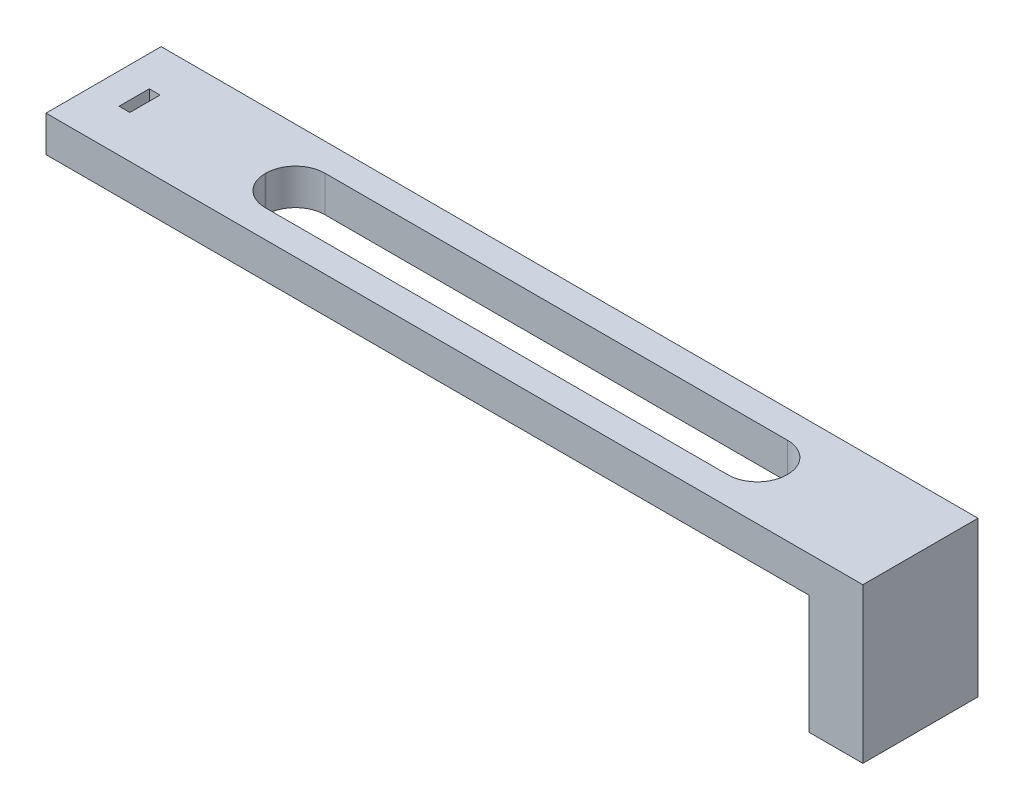
from build123d import *

# Parameters (mm, degrees)
EXTRUDE_1_DEPTH     = 16
SKETCH_2_W          = 1.5
SKETCH_2_H          = 4.2
SKETCH_2_W_2        = 72.5
SKETCH_2_H_2        = 8.3
CUT_EXTRUDE_1_DEPTH = 109.463127375
FILLET_1_R          = 4.1


with BuildPart() as part:
    # 스케치1 → 보스-돌출1 (new body)
    with BuildSketch(Plane.XY):
        Polygon((-106, 0), (0, 0), (0, -16.5), (7.5, -16.5), (7.5, 5), (-106, 5), align=None)
    extrude(amount=EXTRUDE_1_DEPTH)

    # 스케치2 → 컷-돌출1 (cut, through all)
    with BuildSketch(Plane.XZ):
        with Locations((-101, 8)):
            Rectangle(SKETCH_2_W, SKETCH_2_H)
        with Locations((-47.25, 8)):
            Rectangle(SKETCH_2_W_2, SKETCH_2_H_2)
    extrude(amount=-CUT_EXTRUDE_1_DEPTH, mode=Mode.SUBTRACT)

    # 필렛1
    fillet_1_edges = [part.edges().sort_by_distance(p)[0] for p in [
        (-83.5, 2.5, 3.85),
        (-83.5, 2.5, 12.15),
        (-11, 2.5, 12.15),
        (-11, 2.5, 3.85),
    ]]
    fillet(fillet_1_edges, radius=FILLET_1_R)


solid = part.part
